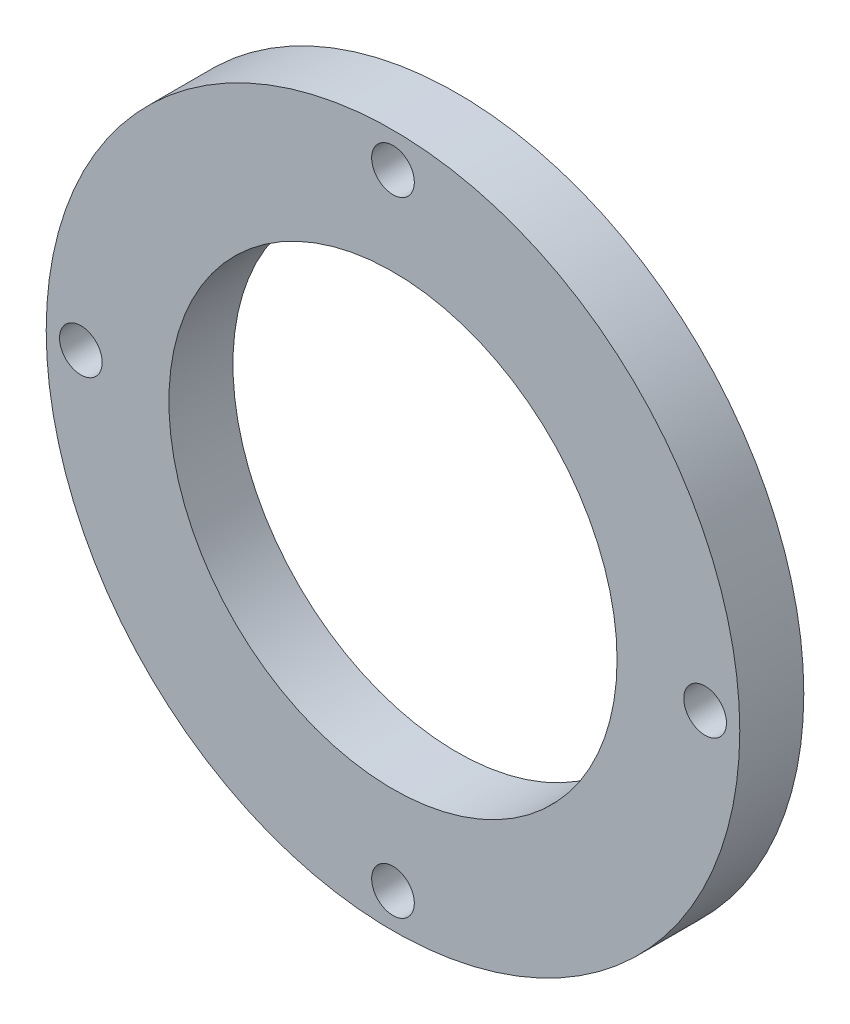
from build123d import *

# Parameters (mm, degrees)
ESQUISSE1_R        = 32.5
ESQUISSE1_R_2      = 21
ESQUISSE1_R_3      = 2
BOSS_EXTRU_1_DEPTH = 6


with BuildPart() as part:
    # Esquisse1 → Boss.-Extru.1 (new body)
    with BuildSketch(Plane.XY):
        Circle(ESQUISSE1_R)
        Circle(ESQUISSE1_R_2, mode=Mode.SUBTRACT)
        with Locations((0, 29.25)):
            Circle(ESQUISSE1_R_3, mode=Mode.SUBTRACT)
        with Locations((29.25, 0)):
            Circle(ESQUISSE1_R_3, mode=Mode.SUBTRACT)
        with Locations((0, -29.25)):
            Circle(ESQUISSE1_R_3, mode=Mode.SUBTRACT)
        with Locations((-29.25, 0)):
            Circle(ESQUISSE1_R_3, mode=Mode.SUBTRACT)
    extrude(amount=BOSS_EXTRU_1_DEPTH)


solid = part.part
